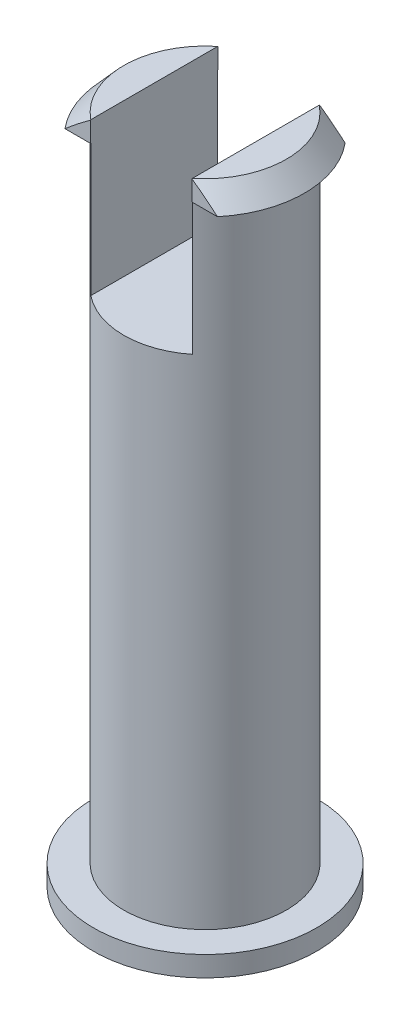
from build123d import *

# Parameters (mm, degrees)
SKETCH1_R           = 4
BOSS_EXTRUDE1_DEPTH = 32
SKETCH4_R           = 5.5
BOSS_EXTRUDE3_DEPTH = 1
BOSS_EXTRUDE4_DEPTH = 1
SKETCH6_W           = 5
SKETCH6_H           = 8
CUT_EXTRUDE2_DEPTH  = 7.5


with BuildPart() as part:
    # Sketch1 → Boss-Extrude1 (new body)
    with BuildSketch(Plane(origin=(0, 0, 0), x_dir=(1, 0, 0), z_dir=(0, 1, 0))):
        with Locations(Location((0, 0, 0), (0, 0, 270))):
            Circle(SKETCH1_R)
    extrude(amount=BOSS_EXTRUDE1_DEPTH)

    # Sketch4 → Boss-Extrude3 (add)
    with BuildSketch(Plane.XZ):
        with Locations(Location((0, 0, 0), (0, 0, 270))):
            Circle(SKETCH4_R)
    extrude(amount=BOSS_EXTRUDE3_DEPTH)

    # Sketch5 → Boss-Extrude4 (add)
    with BuildSketch(Plane(origin=(0, 31, 0), x_dir=(1, 0, 0), z_dir=(0, 1, 0))):
        with BuildLine():
            Line((-3.75, -3.142053469), (3.75, -3.142053469))
            ThreePointArc((3.75, -3.142053469), (4.892340953, 0), (3.75, 3.142053469))
            Line((3.75, 3.142053469), (-3.75, 3.142053469))
            ThreePointArc((-3.75, 3.142053469), (-4.892340953, 0), (-3.75, -3.142053469))
        make_face()
    extrude(amount=BOSS_EXTRUDE4_DEPTH)

    # Sketch6 → Cut-Extrude2 (cut)
    with BuildSketch(Plane(origin=(0, 32, 0), x_dir=(1, 0, 0), z_dir=(0, 1, 0))):
        Rectangle(SKETCH6_W, SKETCH6_H)
    extrude(amount=-CUT_EXTRUDE2_DEPTH, mode=Mode.SUBTRACT)

    # Sketch8 → Cut-Revolve1 (revolve, cut)
    with BuildSketch(Plane.XY, mode=Mode.PRIVATE) as cut_revolve1_sk:
        Polygon((4.892340953, 31), (4, 32), (4.892340953, 32), align=None)
    revolve(cut_revolve1_sk.sketch.rotate(Axis((0, 0, 0), (0, 1, 0)), 90), axis=Axis((0, 0, 0), (0, 1, 0)), mode=Mode.SUBTRACT)


solid = part.part
